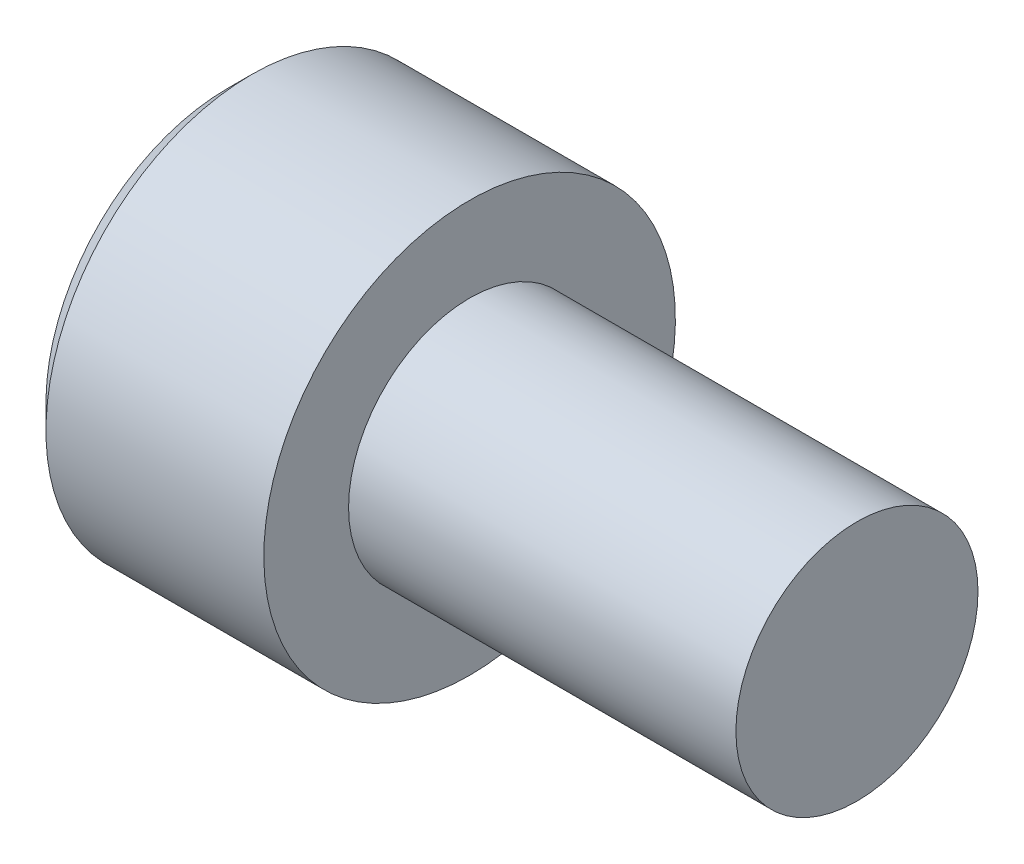
from build123d import *

# Parameters (mm, degrees)
CUT_EXTRUDE1_DEPTH = 2.5
CHAMFER1_SIZE      = 0.5


with BuildPart() as part:
    # Sketch1 → Revolve1 (revolve)
    with BuildSketch(Plane.XY, mode=Mode.PRIVATE) as revolve1_sk:
        Polygon((0, 2.5), (8, 2.5), (8, 0), (-5, 0), (-5, 4.25), (0, 4.25), align=None)
    revolve(revolve1_sk.sketch.rotate(Axis((-5, 0, 0), (1, 0, 0)), 180), axis=Axis((-5, 0, 0), (1, 0, 0)))

    # Sketch2 → Cut-Revolve1 (revolve, cut)
    with BuildSketch(Plane.XY, mode=Mode.PRIVATE) as cut_revolve1_sk:
        Polygon((-1.298278762, 0), (-2.5, 2), (-5, 2), (-5, 0), align=None)
    revolve(cut_revolve1_sk.sketch.rotate(Axis((-5, 0, 0), (1, 0, 0)), 180), axis=Axis((-5, 0, 0), (1, 0, 0)), mode=Mode.SUBTRACT)

    # Sketch3 → Cut-Extrude1 (cut)
    with BuildSketch(Plane.ZY.offset(5)):
        Polygon((2, 1.154700538), (0, 2.309401077), (-2, 1.154700538), (-2, -1.154700538), (0, -2.309401077), (2, -1.154700538), align=None)
    extrude(amount=-CUT_EXTRUDE1_DEPTH, mode=Mode.SUBTRACT)

    # Chamfer1
    chamfer1_edges = [part.edges().sort_by_distance(p)[0] for p in [
        (-5, 4.25, 0),
    ]]
    chamfer(chamfer1_edges, length=CHAMFER1_SIZE)


solid = part.part
